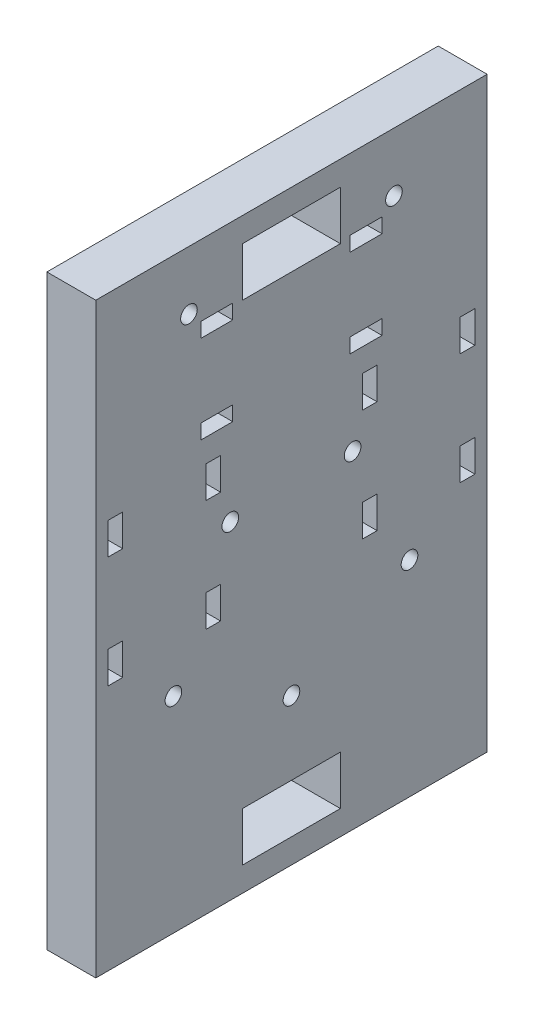
from build123d import *

# Parameters (mm, degrees)
SKETCH3_W                = 100
SKETCH3_H                = 100
SKETCH3_W_2              = 80
SKETCH3_H_2              = 80
BOSS_EXTRUDE1_DEPTH      = 120
CUT_EXTRUDE6_DEPTH       = 186.47236991
CIRPATTERN1_COUNT        = 2
CIRPATTERN1_ANGLE        = 90
SKETCH19_R               = 13.375
SKETCH19_R_2             = 8.4375
BOSS_EXTRUDE3_DEPTH      = 10
BOSS_EXTRUDE4_START      = -110
SKETCH19_2_R             = 13.375
SKETCH19_2_R_2           = 8.4375
BOSS_EXTRUDE4_DEPTH      = 10
CUT_EXTRUDE4_DEPTH       = 186.47236991
CUT_EXTRUDE4_DEPTH_BACK  = 186.47236991
SKETCH8_R                = 8.4375
CUT_EXTRUDE11_START      = 120
SKETCH21_R               = 1.5
CUT_EXTRUDE11_DEPTH      = 10
CUT_EXTRUDE12_START      = 10
SKETCH21_2_R             = 1.5
CUT_EXTRUDE12_DEPTH      = 10
SKETCH9_W                = 10
SKETCH9_H                = 80
ELECTRONICSPLATE_DEPTH   = 120
CUT_EXTRUDE10_REACH      = 187.472
SKETCH18_W               = 80
SKETCH18_H               = 100
BEAGLEBONEHOLES_START    = 40
SKETCH12_R               = 1.7
BEAGLEBONEHOLES_DEPTH    = 10
RFDHOLES_START           = 40
SKETCH13_R               = 1.7
RFDHOLES_DEPTH           = 10
ANTENNACAVITY_START      = 30
SKETCH35_W               = 12
SKETCH35_H               = 43
ANTENNACAVITY_DEPTH      = 5
ZIPTIEHOLES_START        = 30
SKETCH36_W               = 3
SKETCH36_H               = 6.5
SKETCH36_W_2             = 6.5
SKETCH36_H_2             = 3
ZIPTIEHOLES_DEPTH        = 10
CUT_EXTRUDE16_START      = 30
SKETCH36_3_W             = 17
SKETCH36_3_H             = 6.5
SKETCH36_3_W_2           = 6.5
SKETCH36_3_H_2           = 15
CUT_EXTRUDE16_DEPTH      = 5
WIREHOLES_START          = 40
SKETCH37_W               = 10
SKETCH37_H               = 10
WIREHOLES_DEPTH          = 10
CUT_EXTRUDE17_DEPTH      = 186.47236991
CUT_EXTRUDE17_DEPTH_BACK = 186.47236991
SKETCH39_W               = 30
SKETCH39_H               = 100
SKETCH39_W_2             = 60
SKETCH39_W_3             = 10
SKETCH39_H_2             = 10


with BuildPart() as part:
    # Sketch3 → Boss-Extrude1 (new body)
    with BuildSketch(Plane(origin=(0, 0, 0), x_dir=(1, 0, 0), z_dir=(0, 1, 0))):
        with Locations((50, 50)):
            Rectangle(SKETCH3_W, SKETCH3_H)
        with Locations((50, 50)):
            Rectangle(SKETCH3_W_2, SKETCH3_H_2, mode=Mode.SUBTRACT)
    extrude(amount=BOSS_EXTRUDE1_DEPTH)

    # Sketch6 → Cut-Extrude6 (cut, symmetric)
    with BuildSketch(Plane.XY):
        Polygon((14.84187473, 110), (50, 67.810249676), (85.15812527, 110), align=None)
        Polygon((56.508541397, 60), (90, 100.189750324), (90, 19.810249676), align=None)
        Polygon((14.84187473, 10), (50, 52.189750324), (85.15812527, 10), align=None)
        Polygon((10, 19.810249676), (43.491458603, 60), (10, 100.189750324), align=None)
    cut_extrude6 = extrude(amount=CUT_EXTRUDE6_DEPTH, both=True, mode=Mode.SUBTRACT)

    # CirPattern1: Cut-Extrude6 ×2 about axis
    cirpattern1_axis = Axis((50, 0, -50), (0, 1, 0))
    for i in range(1, CIRPATTERN1_COUNT):
        add(cut_extrude6.rotate(cirpattern1_axis, i * CIRPATTERN1_ANGLE / (CIRPATTERN1_COUNT - 1)), mode=Mode.SUBTRACT)

    # Sketch19 → Boss-Extrude3 (add)
    # profile 1 of 4: a face of its own
    with BuildSketch(Plane(origin=(0, 120, 0), x_dir=(1, 0, 0), z_dir=(0, 1, 0))):
        with Locations((13.375, 86.625)):
            Circle(SKETCH19_R)
        with Locations((13.375, 86.625)):
            Circle(SKETCH19_R_2, mode=Mode.SUBTRACT)
    # profile 2 of 4: a face of its own
    with BuildSketch(Plane(origin=(0, 120, 0), x_dir=(1, 0, 0), z_dir=(0, 1, 0))):
        with Locations((86.625, 86.625)):
            Circle(SKETCH19_R)
        with Locations((86.625, 86.625)):
            Circle(SKETCH19_R_2, mode=Mode.SUBTRACT)
    # profile 3 of 4: a face of its own
    with BuildSketch(Plane(origin=(0, 120, 0), x_dir=(1, 0, 0), z_dir=(0, 1, 0))):
        with Locations((86.625, 13.375)):
            Circle(SKETCH19_R)
        with Locations((86.625, 13.375)):
            Circle(SKETCH19_R_2, mode=Mode.SUBTRACT)
    # profile 4 of 4: a face of its own
    with BuildSketch(Plane(origin=(0, 120, 0), x_dir=(1, 0, 0), z_dir=(0, 1, 0))):
        with Locations((13.375, 13.375)):
            Circle(SKETCH19_R)
        with Locations((13.375, 13.375)):
            Circle(SKETCH19_R_2, mode=Mode.SUBTRACT)
    extrude(amount=-BOSS_EXTRUDE3_DEPTH)

    # Sketch19<2> → Boss-Extrude4 (add)
    # profile 1 of 4: a face of its own
    with BuildSketch(Plane(origin=(0, 120, 0), x_dir=(1, 0, 0), z_dir=(0, 1, 0)).offset(BOSS_EXTRUDE4_START)):
        with Locations((13.375, 86.625)):
            Circle(SKETCH19_2_R)
    # profile 2 of 4: a face of its own
    with BuildSketch(Plane(origin=(0, 120, 0), x_dir=(1, 0, 0), z_dir=(0, 1, 0)).offset(BOSS_EXTRUDE4_START)):
        with Locations((86.625, 86.625)):
            Circle(SKETCH19_2_R)
        with Locations((86.625, 86.625)):
            Circle(SKETCH19_2_R_2, mode=Mode.SUBTRACT)
    # profile 3 of 4: a face of its own
    with BuildSketch(Plane(origin=(0, 120, 0), x_dir=(1, 0, 0), z_dir=(0, 1, 0)).offset(BOSS_EXTRUDE4_START)):
        with Locations((86.625, 13.375)):
            Circle(SKETCH19_2_R)
        with Locations((86.625, 13.375)):
            Circle(SKETCH19_2_R_2, mode=Mode.SUBTRACT)
    # profile 4 of 4: a face of its own
    with BuildSketch(Plane(origin=(0, 120, 0), x_dir=(1, 0, 0), z_dir=(0, 1, 0)).offset(BOSS_EXTRUDE4_START)):
        with Locations((13.375, 13.375)):
            Circle(SKETCH19_2_R)
        with Locations((13.375, 13.375)):
            Circle(SKETCH19_2_R_2, mode=Mode.SUBTRACT)
    extrude(amount=-BOSS_EXTRUDE4_DEPTH)

    # Sketch8 → Cut-Extrude4 (cut, two sides: drawn at the far end of the back side and taken through both)
    with BuildSketch(Plane(origin=(0, 0, 0), x_dir=(1, 0, 0), z_dir=(0, 1, 0)).offset(-CUT_EXTRUDE4_DEPTH_BACK)):
        with Locations(Location((13.375, 86.625, 0), (0, 0, 90))):
            Circle(SKETCH8_R)
        with Locations(Location((86.625, 86.625, 0), (0, 0, 90))):
            Circle(SKETCH8_R)
        with Locations(Location((13.375, 13.375, 0), (0, 0, 90))):
            Circle(SKETCH8_R)
        with Locations(Location((86.625, 13.375, 0), (0, 0, 90))):
            Circle(SKETCH8_R)
    extrude(amount=CUT_EXTRUDE4_DEPTH + CUT_EXTRUDE4_DEPTH_BACK, mode=Mode.SUBTRACT)

    # Sketch21 → Cut-Extrude11 (cut)
    with BuildSketch(Plane(origin=(0, 0, 0), x_dir=(1, 0, 0), z_dir=(0, 1, 0)).offset(CUT_EXTRUDE11_START)):
        with Locations(Location((5, 50, 0), (0, 0, 270))):
            Circle(SKETCH21_R)
        with Locations(Location((50, 95, 0), (0, 0, 270))):
            Circle(SKETCH21_R)
        with Locations(Location((95, 50, 0), (0, 0, 270))):
            Circle(SKETCH21_R)
        with Locations(Location((50, 5, 0), (0, 0, 270))):
            Circle(SKETCH21_R)
    extrude(amount=-CUT_EXTRUDE11_DEPTH, mode=Mode.SUBTRACT)

    # Sketch21<2> → Cut-Extrude12 (cut)
    with BuildSketch(Plane(origin=(0, 0, 0), x_dir=(1, 0, 0), z_dir=(0, 1, 0)).offset(CUT_EXTRUDE12_START)):
        with Locations(Location((5, 50, 0), (0, 0, 270))):
            Circle(SKETCH21_2_R)
        with Locations(Location((50, 95, 0), (0, 0, 270))):
            Circle(SKETCH21_2_R)
        with Locations(Location((95, 50, 0), (0, 0, 270))):
            Circle(SKETCH21_2_R)
        with Locations(Location((50, 5, 0), (0, 0, 270))):
            Circle(SKETCH21_2_R)
    extrude(amount=-CUT_EXTRUDE12_DEPTH, mode=Mode.SUBTRACT)

    # Sketch9 → ElectronicsPlate (add)
    with BuildSketch(Plane(origin=(0, 0, 0), x_dir=(1, 0, 0), z_dir=(0, 1, 0))):
        with Locations((35, 50)):
            Rectangle(SKETCH9_W, SKETCH9_H)
    extrude(amount=ELECTRONICSPLATE_DEPTH)

    # Sketch18 → Cut-Extrude10 (cut, up to next)
    with BuildSketch(Plane.ZY, mode=Mode.PRIVATE) as cut_extrude10_sk1:
        with Locations((-50, 60)):
            Rectangle(SKETCH18_W, SKETCH18_H)
    cut_extrude10_tool1 = extrude(cut_extrude10_sk1.sketch, amount=-CUT_EXTRUDE10_REACH, mode=Mode.PRIVATE) & part.part
    add(cut_extrude10_tool1.solids().sort_by_distance((0, 60, -50))[0], mode=Mode.SUBTRACT)

    # Sketch12 → BeagleboneHoles (cut)
    with BuildSketch(Plane(origin=(0, 0, 0), x_dir=(0, 0, -1), z_dir=(1, 0, 0)).offset(BEAGLEBONEHOLES_START)):
        with Locations((25.87, 41.96)):
            Circle(SKETCH12_R)
        with Locations((74.13, 41.96)):
            Circle(SKETCH12_R)
        with Locations((29.045, 108)):
            Circle(SKETCH12_R)
        with Locations((70.955, 108)):
            Circle(SKETCH12_R)
    extrude(amount=-BEAGLEBONEHOLES_DEPTH, mode=Mode.SUBTRACT)

    # Sketch13 → RFDHoles (cut)
    with BuildSketch(Plane(origin=(0, 0, 0), x_dir=(0, 0, -1), z_dir=(1, 0, 0)).offset(RFDHOLES_START)):
        with Locations((50, 30)):
            Circle(SKETCH13_R)
        with Locations((37.5, 67)):
            Circle(SKETCH13_R)
        with Locations((62.5, 67)):
            Circle(SKETCH13_R)
    extrude(amount=-RFDHOLES_DEPTH, mode=Mode.SUBTRACT)

    # Sketch35 → AntennaCavity (cut)
    with BuildSketch(Plane(origin=(0, 0, 0), x_dir=(0, 0, -1), z_dir=(1, 0, 0)).offset(ANTENNACAVITY_START)):
        with Locations((24, 68.5)):
            Rectangle(SKETCH35_W, SKETCH35_H)
        Polygon((18, 90), (30, 90), (50, 90), (50, 100), (18, 100), align=None)
        Polygon((50, 100), (50, 90), (70, 90), (82, 90), (82, 100), align=None)
        with Locations((76, 68.5)):
            Rectangle(SKETCH35_W, SKETCH35_H)
    extrude(amount=ANTENNACAVITY_DEPTH, mode=Mode.SUBTRACT)

    # Sketch36 → ZiptieHoles (cut)
    with BuildSketch(Plane(origin=(0, 0, 0), x_dir=(0, 0, -1), z_dir=(1, 0, 0)).offset(ZIPTIEHOLES_START)):
        with Locations((34, 53.701837694)):
            Rectangle(SKETCH36_W, SKETCH36_H)
        with Locations((14, 53.701837694)):
            Rectangle(SKETCH36_W, SKETCH36_H)
        with Locations((34, 76.513807116)):
            Rectangle(SKETCH36_W, SKETCH36_H)
        with Locations((14, 76.513807116)):
            Rectangle(SKETCH36_W, SKETCH36_H)
        with Locations((34.734232458, 86)):
            Rectangle(SKETCH36_W_2, SKETCH36_H_2)
        with Locations((34.734232458, 104)):
            Rectangle(SKETCH36_W_2, SKETCH36_H_2)
        with Locations((65.265767542, 104)):
            Rectangle(SKETCH36_W_2, SKETCH36_H_2)
        with Locations((65.265767542, 86)):
            Rectangle(SKETCH36_W_2, SKETCH36_H_2)
        with Locations((66, 76.513807116)):
            Rectangle(SKETCH36_W, SKETCH36_H)
        with Locations((86, 76.513807116)):
            Rectangle(SKETCH36_W, SKETCH36_H)
        with Locations((86, 53.701837694)):
            Rectangle(SKETCH36_W, SKETCH36_H)
        with Locations((66, 53.701837694)):
            Rectangle(SKETCH36_W, SKETCH36_H)
    extrude(amount=ZIPTIEHOLES_DEPTH, mode=Mode.SUBTRACT)

    # Sketch36<3> → Cut-Extrude16 (cut)
    with BuildSketch(Plane(origin=(0, 0, 0), x_dir=(0, 0, -1), z_dir=(1, 0, 0)).offset(CUT_EXTRUDE16_START)):
        with Locations((24, 76.513807116)):
            Rectangle(SKETCH36_3_W, SKETCH36_3_H)
        with Locations((34.734232458, 95)):
            Rectangle(SKETCH36_3_W_2, SKETCH36_3_H_2)
        with Locations((65.265767542, 95)):
            Rectangle(SKETCH36_3_W_2, SKETCH36_3_H_2)
        with Locations((76, 76.513807116)):
            Rectangle(SKETCH36_3_W, SKETCH36_3_H)
        with Locations((76, 53.701837694)):
            Rectangle(SKETCH36_3_W, SKETCH36_3_H)
        with Locations((24, 53.701837694)):
            Rectangle(SKETCH36_3_W, SKETCH36_3_H)
    extrude(amount=CUT_EXTRUDE16_DEPTH, mode=Mode.SUBTRACT)

    # Sketch37 → WireHoles (cut)
    with BuildSketch(Plane(origin=(0, 0, 0), x_dir=(0, 0, -1), z_dir=(1, 0, 0)).offset(WIREHOLES_START)):
        with Locations((45, 10)):
            Rectangle(SKETCH37_W, SKETCH37_H)
        with Locations((55, 10)):
            Rectangle(SKETCH37_W, SKETCH37_H)
        with Locations((55, 110)):
            Rectangle(SKETCH37_W, SKETCH37_H)
        with Locations((45, 110)):
            Rectangle(SKETCH37_W, SKETCH37_H)
    extrude(amount=-WIREHOLES_DEPTH, mode=Mode.SUBTRACT)

    # Sketch39 → Cut-Extrude17 (cut, two sides: drawn at the far end of the back side and taken through both)
    with BuildSketch(Plane(origin=(0, 0, 0), x_dir=(1, 0, 0), z_dir=(0, 1, 0)).offset(-CUT_EXTRUDE17_DEPTH_BACK)):
        with Locations((15, 50)):
            Rectangle(SKETCH39_W, SKETCH39_H)
        with Locations((70, 50)):
            Rectangle(SKETCH39_W_2, SKETCH39_H)
        with Locations((35, 95)):
            Rectangle(SKETCH39_W_3, SKETCH39_H_2)
        with Locations((35, 5)):
            Rectangle(SKETCH39_W_3, SKETCH39_H_2)
    extrude(amount=CUT_EXTRUDE17_DEPTH + CUT_EXTRUDE17_DEPTH_BACK, mode=Mode.SUBTRACT)


solid = part.part
